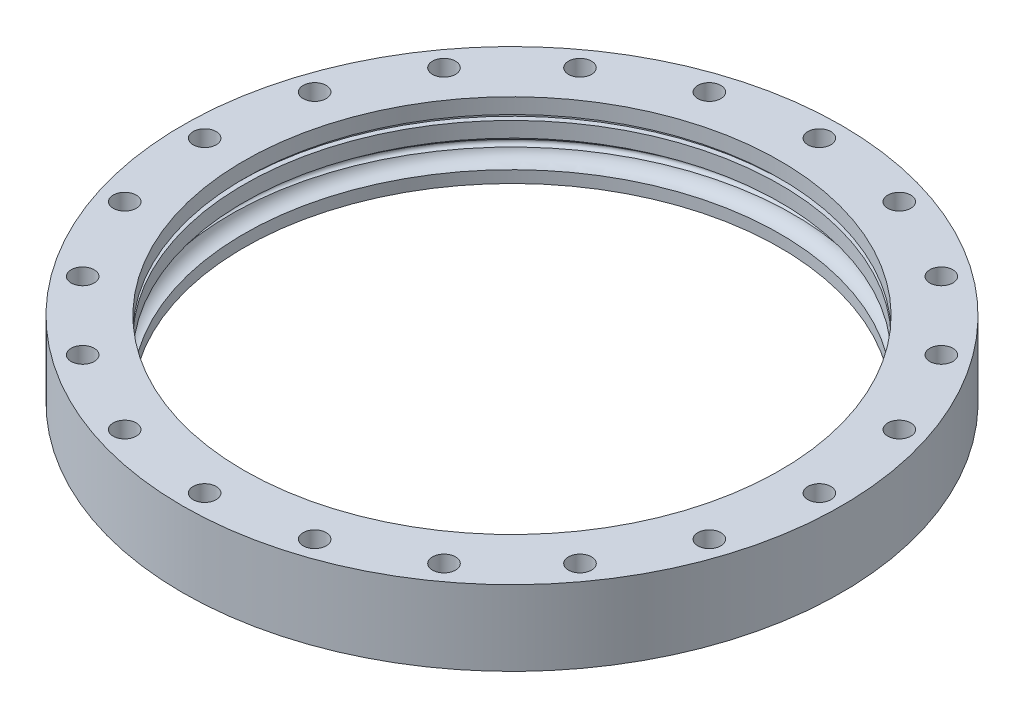
from build123d import *

# Parameters (mm, degrees)
ESQUISSE4_R             = 6.75
ENL_V_MAT_EXTRU_2_DEPTH = 277.466996222


with BuildPart() as part:
    # Esquisse1 → Révolution1 (revolve)
    with BuildSketch(Plane.XY):
        with BuildLine():
            Line((-193, 44), (-193, 0))
            Line((-193, 0), (-157, 0))
            Line((-157, 0), (-157, 7))
            ThreePointArc((-157, 7), (-161.905379299, 8.680407139), (-164.75, 13.015686517))
            ThreePointArc((-164.75, 13.015686517), (-166, 13.677124344), (-166.5, 15))
            ThreePointArc((-166.5, 15), (-166, 16.322875656), (-164.75, 16.984313483))
            ThreePointArc((-164.75, 16.984313483), (-161.905379299, 21.319592861), (-157, 23))
            Line((-157, 23), (-157, 32))
            Line((-157, 32), (-160, 32))
            Line((-160, 32), (-160, 35))
            Line((-160, 35), (-157, 35))
            Line((-157, 35), (-157, 44))
            Line((-157, 44), (-193, 44))
        make_face()
    revolve(axis=Axis((0, 44, 0), (0, -1, 0)))

    # Esquisse4 → Enlèv. mat.-Extru.2 (cut, through all)
    with BuildSketch(Plane(origin=(0, 44, 0), x_dir=(1, 0, 0), z_dir=(0, 1, 0))):
        with Locations((-180, 0)):
            Circle(ESQUISSE4_R)
        with Locations((-171.190172933, 55.623058987)):
            Circle(ESQUISSE4_R)
        with Locations((-145.623058987, 105.801345413)):
            Circle(ESQUISSE4_R)
        with Locations((-105.801345413, 145.623058987)):
            Circle(ESQUISSE4_R)
        with Locations((-55.623058987, 171.190172933)):
            Circle(ESQUISSE4_R)
        with Locations((0, 180)):
            Circle(ESQUISSE4_R)
        with Locations((55.623058987, 171.190172933)):
            Circle(ESQUISSE4_R)
        with Locations((105.801345413, 145.623058987)):
            Circle(ESQUISSE4_R)
        with Locations((145.623058987, 105.801345413)):
            Circle(ESQUISSE4_R)
        with Locations((171.190172933, 55.623058987)):
            Circle(ESQUISSE4_R)
        with Locations((180, 0)):
            Circle(ESQUISSE4_R)
        with Locations((171.190172933, -55.623058987)):
            Circle(ESQUISSE4_R)
        with Locations((145.623058987, -105.801345413)):
            Circle(ESQUISSE4_R)
        with Locations((105.801345413, -145.623058987)):
            Circle(ESQUISSE4_R)
        with Locations((55.623058987, -171.190172933)):
            Circle(ESQUISSE4_R)
        with Locations((0, -180)):
            Circle(ESQUISSE4_R)
        with Locations((-55.623058987, -171.190172933)):
            Circle(ESQUISSE4_R)
        with Locations((-105.801345413, -145.623058987)):
            Circle(ESQUISSE4_R)
        with Locations((-145.623058987, -105.801345413)):
            Circle(ESQUISSE4_R)
        with Locations((-171.190172933, -55.623058987)):
            Circle(ESQUISSE4_R)
    extrude(amount=-ENL_V_MAT_EXTRU_2_DEPTH, mode=Mode.SUBTRACT)


solid = part.part
